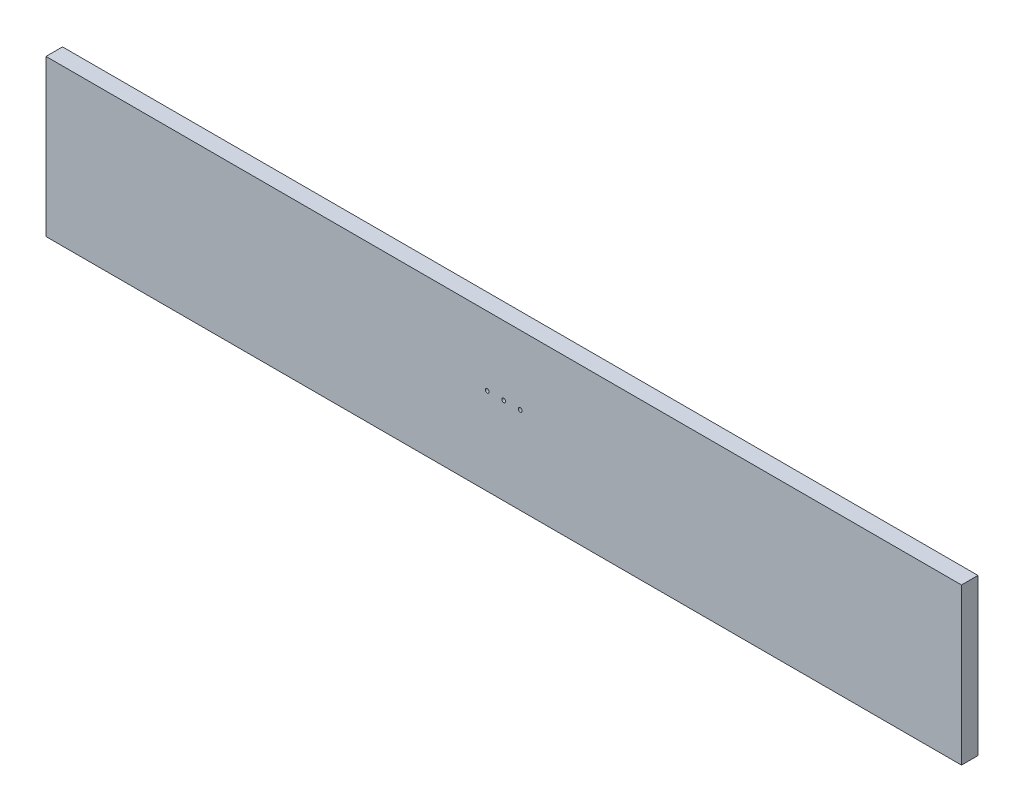
from build123d import *

# Parameters (mm, degrees)
SKETCH_1_W          = 704
SKETCH_1_H          = 120
EXTRUDE_1_DEPTH     = 12.7
SKETCH_2_R          = 1.5
CUT_EXTRUDE_1_DEPTH = 358.302798758


with BuildPart() as part:
    # 草图1 → 凸台-拉伸1 (new body)
    with BuildSketch(Plane.XY):
        Rectangle(SKETCH_1_W, SKETCH_1_H)
    extrude(amount=EXTRUDE_1_DEPTH)

    # 草图2 → 切除-拉伸1 (cut, through all)
    with BuildSketch(Plane.XY.offset(12.7)):
        with Locations((12.69, 6.92)):
            Circle(SKETCH_2_R)
        with Locations((-0.01, 6.92)):
            Circle(SKETCH_2_R)
        with Locations((-12.71, 6.92)):
            Circle(SKETCH_2_R)
    extrude(amount=-CUT_EXTRUDE_1_DEPTH, mode=Mode.SUBTRACT)


solid = part.part
